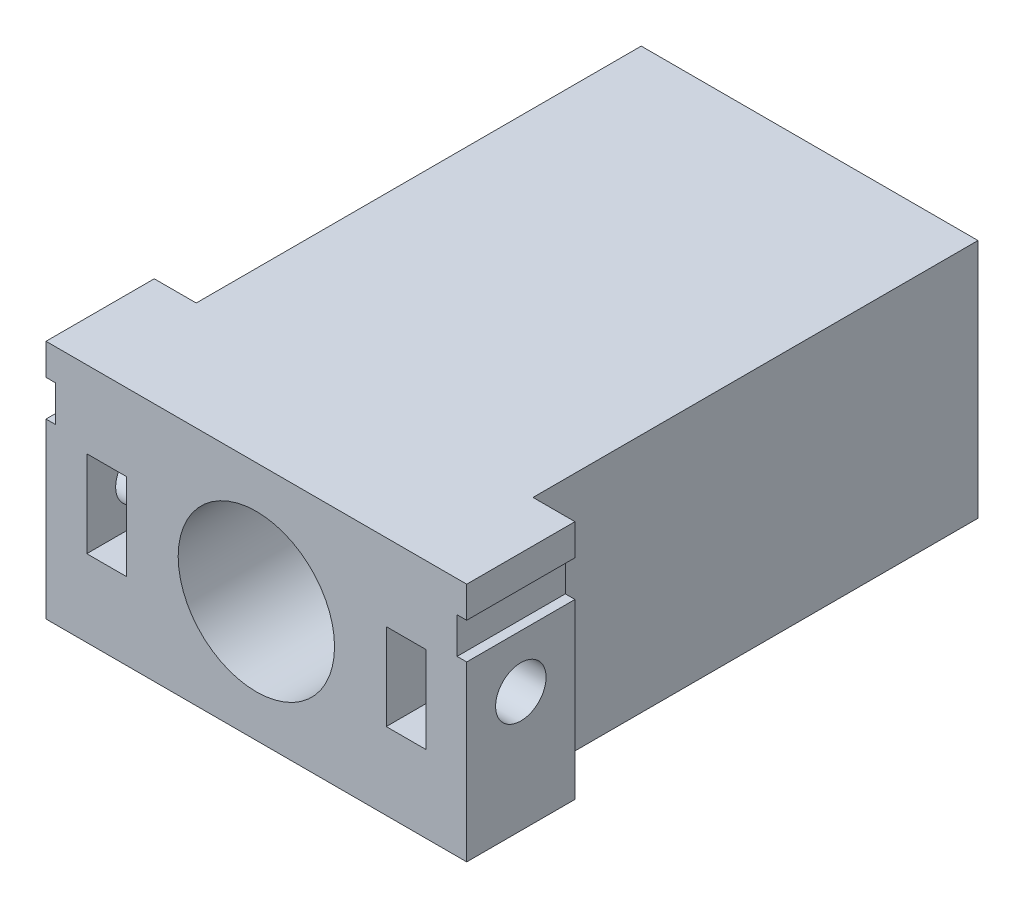
from build123d import *

# Parameters (mm, degrees)
SZKIC1_W                    = 28
SZKIC1_H                    = 20
SZKIC1_R                    = 6.5
DODANIE_WYCI_GNI_CIE1_DEPTH = 46
SZKIC2_W                    = 0.1
SZKIC2_H                    = 9
DODANIE_WYCI_GNI_CIE2_DEPTH = 20
WYTNIJ_WYCI_GNI_CIE1_DEPTH  = 3.3
WYTNIJ_WYCI_GNI_CIE2_DEPTH  = 3.3
SZKIC5_W                    = 9
SZKIC5_H                    = 20
SZKIC5_R                    = 2.1
DODANIE_WYCI_GNI_CIE3_DEPTH = 3.39
DODANIE_WYCI_GNI_CIE4_START = 3.39
SZKIC6_W                    = 9
SZKIC6_H                    = 20
SZKIC6_R                    = 2.1
DODANIE_WYCI_GNI_CIE4_DEPTH = 3.39
SZKIC7_W                    = 9.448344777
SZKIC7_H                    = 3
WYTNIJ_WYCI_GNI_CIE3_DEPTH  = 0.8
SZKIC8_W                    = 9
SZKIC8_H                    = 3
WYTNIJ_WYCI_GNI_CIE4_DEPTH  = 0.8


with BuildPart() as part:
    # Szkic1 → Dodanie-wyciągnięcie1 (new body)
    with BuildSketch(Plane.XY):
        Rectangle(SZKIC1_W, SZKIC1_H)
        Circle(SZKIC1_R, mode=Mode.SUBTRACT)
    extrude(amount=DODANIE_WYCI_GNI_CIE1_DEPTH)

    # Szkic2 → Dodanie-wyciągnięcie2 (add)
    with BuildSketch(Plane(origin=(0, 10, 0), x_dir=(1, 0, 0), z_dir=(0, 1, 0))):
        with Locations((-14.05, -41.5)):
            Rectangle(SZKIC2_W, SZKIC2_H)
        with Locations((14.05, -41.5)):
            Rectangle(SZKIC2_W, SZKIC2_H)
    extrude(amount=-DODANIE_WYCI_GNI_CIE2_DEPTH)

    # Szkic3 → Wytnij-wyciągnięcie1 (cut)
    with BuildSketch(Plane(origin=(14.1, 0, 0), x_dir=(0, 0, -1), z_dir=(1, 0, 0))):
        Polygon((-39.421539031, -3.6), (-37.343078062, 0), (-39.421539031, 3.6), (-46, 3.6), (-46, -3.6), align=None)
    extrude(amount=-WYTNIJ_WYCI_GNI_CIE1_DEPTH, mode=Mode.SUBTRACT)

    # Szkic4 → Wytnij-wyciągnięcie2 (cut)
    with BuildSketch(Plane.ZY.offset(14.1)):
        Polygon((41.5, 3.6), (39.421539031, 3.6), (37.343078062, 0), (39.421539031, -3.6), (46, -3.6), (46, 3.6), align=None)
    extrude(amount=-WYTNIJ_WYCI_GNI_CIE2_DEPTH, mode=Mode.SUBTRACT)

    # Szkic5 → Dodanie-wyciągnięcie3 (add)
    with BuildSketch(Plane.ZY.offset(14.1)):
        with Locations((41.5, 0)):
            Rectangle(SZKIC5_W, SZKIC5_H)
        with Locations((41.5, 0)):
            Circle(SZKIC5_R, mode=Mode.SUBTRACT)
    extrude(amount=DODANIE_WYCI_GNI_CIE3_DEPTH)

    # Szkic6 → Dodanie-wyciągnięcie4 (add)
    with BuildSketch(Plane(origin=(14.1, 0, 0), x_dir=(0, 0, -1), z_dir=(1, 0, 0)).offset(DODANIE_WYCI_GNI_CIE4_START)):
        with Locations((-41.5, 0)):
            Rectangle(SZKIC6_W, SZKIC6_H)
        with Locations(Location((-41.5, 0, 0), (0, 0, 180))):
            Circle(SZKIC6_R, mode=Mode.SUBTRACT)
    extrude(amount=-DODANIE_WYCI_GNI_CIE4_DEPTH)

    # Szkic7 → Wytnij-wyciągnięcie3 (cut)
    with BuildSketch(Plane.ZY.offset(17.49)):
        with Locations((41.724172389, 5.9)):
            Rectangle(SZKIC7_W, SZKIC7_H)
    extrude(amount=-WYTNIJ_WYCI_GNI_CIE3_DEPTH, mode=Mode.SUBTRACT)

    # Szkic8 → Wytnij-wyciągnięcie4 (cut)
    with BuildSketch(Plane(origin=(17.49, 0, 0), x_dir=(0, 0, -1), z_dir=(1, 0, 0))):
        with Locations((-41.5, 5.9)):
            Rectangle(SZKIC8_W, SZKIC8_H)
    extrude(amount=-WYTNIJ_WYCI_GNI_CIE4_DEPTH, mode=Mode.SUBTRACT)


solid = part.part
